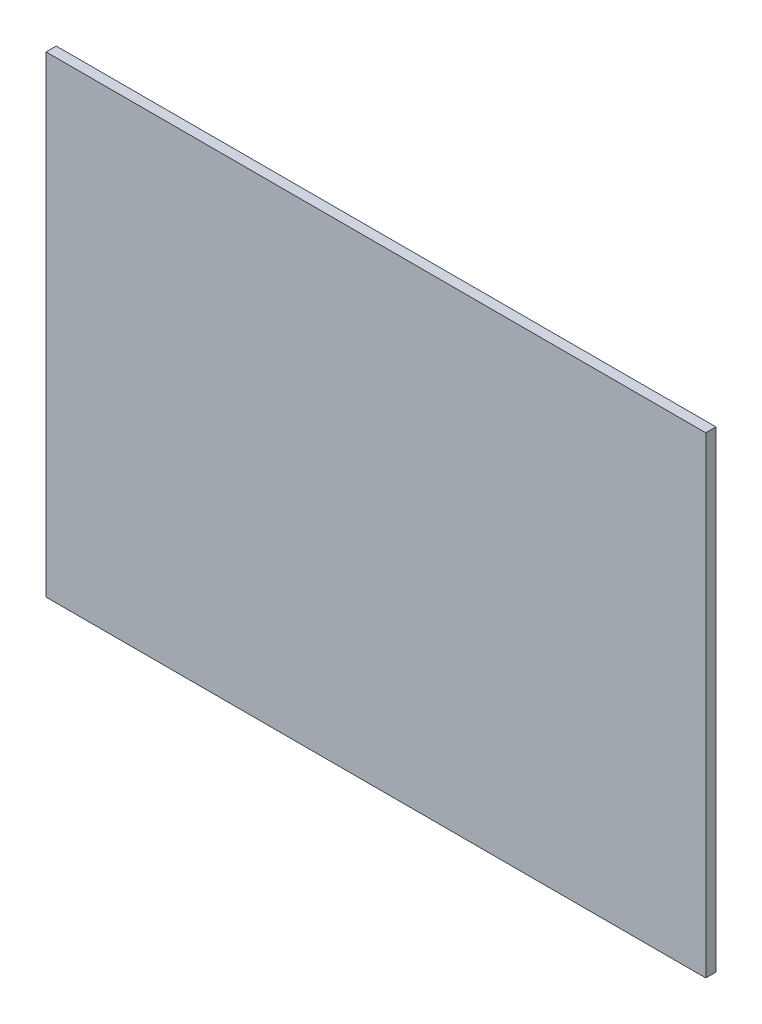
from build123d import *

# Parameters (mm, degrees)
ESBO_O1_W                = 110
ESBO_O1_H                = 78.72
RESSALTO_EXTRUS_O1_DEPTH = 1.7


with BuildPart() as part:
    # Esboço1 → Ressalto-extrusão1 (new body)
    with BuildSketch(Plane.XY):
        with Locations((-408.571428571, 212.425714286)):
            Rectangle(ESBO_O1_W, ESBO_O1_H)
    extrude(amount=RESSALTO_EXTRUS_O1_DEPTH)


solid = part.part
